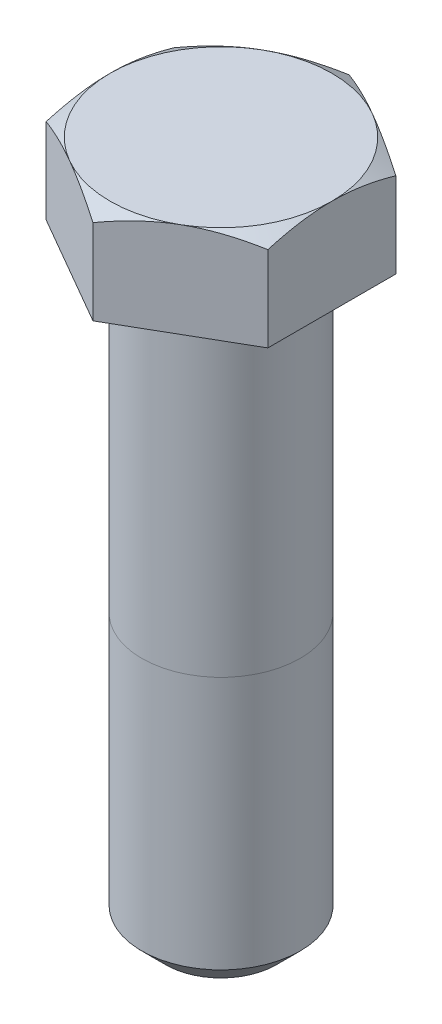
from build123d import *

# Parameters (mm, degrees)
BOSS_EXTRUDE1_DEPTH = 12
SKETCH2_OUTSIDE_W   = 127.296
SKETCH2_OUTSIDE_H   = 131.628
SKETCH2_OUTSIDE_R   = 14
CUT_EXTRUDE1_DEPTH  = 25.522098877
CUT_EXTRUDE1_DRAFT  = -60
SKETCH3_R           = 10
BOSS_EXTRUDE2_DEPTH = 75
CHAMFER1_SIZE       = 3


with BuildPart() as part:
    # Sketch1 → Boss-Extrude1 (new body)
    with BuildSketch(Plane(origin=(0, 0, 0), x_dir=(1, 0, 0), z_dir=(0, 1, 0))):
        Polygon((0, -16.165807537), (14, -8.082903769), (14, 8.082903769), (0, 16.165807537), (-14, 8.082903769), (-14, -8.082903769), align=None)
    extrude(amount=BOSS_EXTRUDE1_DEPTH)


with BuildPart() as cut_extrude1_tool:
    # Sketch2 outside → Cut-Extrude1 (with draft: the straight prism first)
    with BuildSketch(Plane(origin=(0, 12, 0), x_dir=(1, 0, 0), z_dir=(0, 1, 0))):
        Rectangle(SKETCH2_OUTSIDE_W, SKETCH2_OUTSIDE_H)
        Circle(SKETCH2_OUTSIDE_R, mode=Mode.SUBTRACT)
    extrude(amount=-CUT_EXTRUDE1_DEPTH)
    # Cut-Extrude1: the draft: its side faces are tilted about the plane it starts from
    cut_extrude1_sides = [cut_extrude1_tool.faces().sort_by_distance(p)[0] for p in [
        (0, -0.761049438, 65.814),
        (63.648, -0.761049438, 0),
        (0, -0.761049438, -65.814),
        (-63.648, -0.761049438, 0),
        (-14, -0.761049438, 0),
    ]]
    draft(cut_extrude1_sides, Plane(origin=(0, 12, 0), x_dir=(1, 0, 0), z_dir=(0, 1, 0)), CUT_EXTRUDE1_DRAFT)


with BuildPart() as part_1:
    add(part.part)

    # Cut-Extrude1: cut by cut_extrude1_tool
    add(cut_extrude1_tool.part, mode=Mode.SUBTRACT)

    # Sketch3 → Boss-Extrude2 (add)
    with BuildSketch(Plane.XZ):
        with Locations(Location((0, 0, 0), (0, 0, 270))):
            Circle(SKETCH3_R)
    extrude(amount=BOSS_EXTRUDE2_DEPTH)

    # Chamfer1
    chamfer1_edges = [part_1.edges().sort_by_distance(p)[0] for p in [
        (0, -75, 10),
    ]]
    chamfer(chamfer1_edges, length=CHAMFER1_SIZE)


solid = part_1.part
